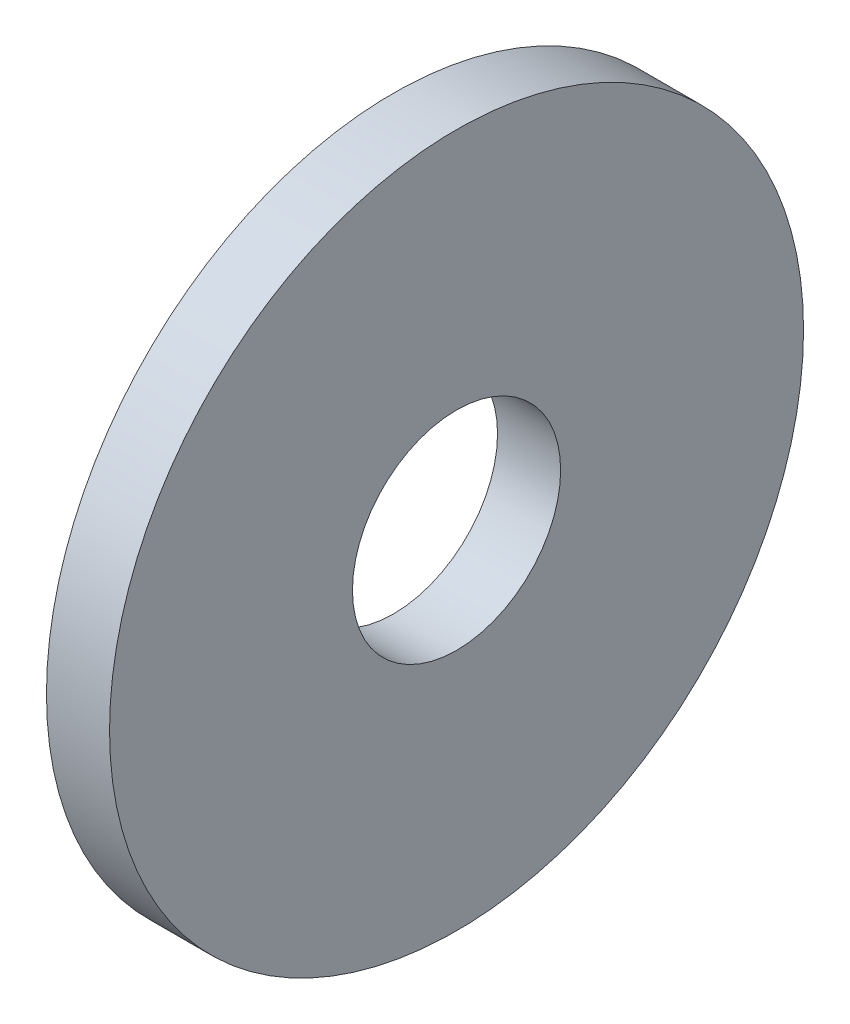
from build123d import *

# Parameters (mm, degrees)
SKETCH1_W = 2
SKETCH1_H = 7.7


with BuildPart() as part:
    # Sketch1 → Base-Revolve (revolve)
    with BuildSketch(Plane.XY, mode=Mode.PRIVATE) as base_revolve_sk:
        with Locations((-1, 7.15)):
            Rectangle(SKETCH1_W, SKETCH1_H)
    revolve(base_revolve_sk.sketch.rotate(Axis((-34.925, 0, 0), (1, 0, 0)), 90), axis=Axis((-34.925, 0, 0), (1, 0, 0)))


solid = part.part
